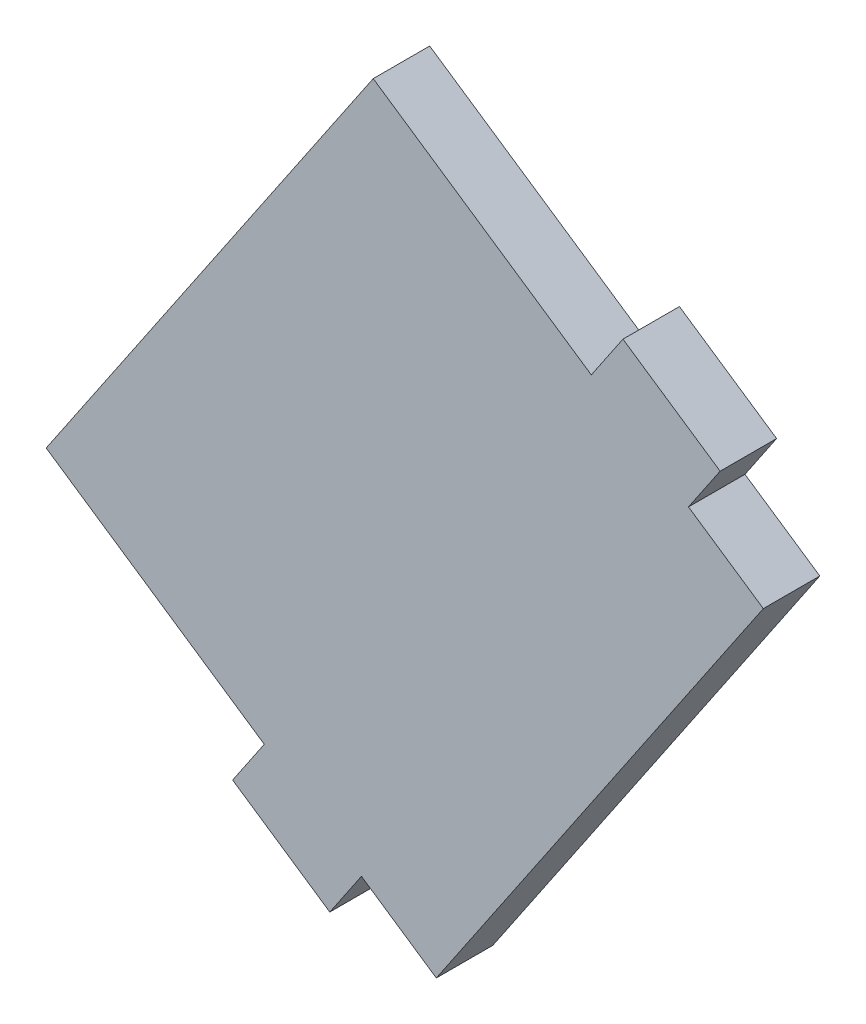
from build123d import *

# Parameters (mm, degrees)
BASE_EXTRUDE_DEPTH = 3


with BuildPart() as part:
    # Sketch1 → Base-Extrude (new body)
    with BuildSketch(Plane.XY):
        Polygon((596.881202269, 476.960415493), (614.251157678, 502.636954378), (625.835092421, 494.800523196), (627.516055848, 497.28534954), (632.677708396, 493.793536449), (630.99674497, 491.308710106), (634.97246712, 488.619168623), (617.602511711, 462.942629738), (613.626789561, 465.632171221), (611.945826134, 463.147344877), (606.784173586, 466.639157968), (608.465137013, 469.123984312), align=None)
    extrude(amount=BASE_EXTRUDE_DEPTH)


solid = part.part
